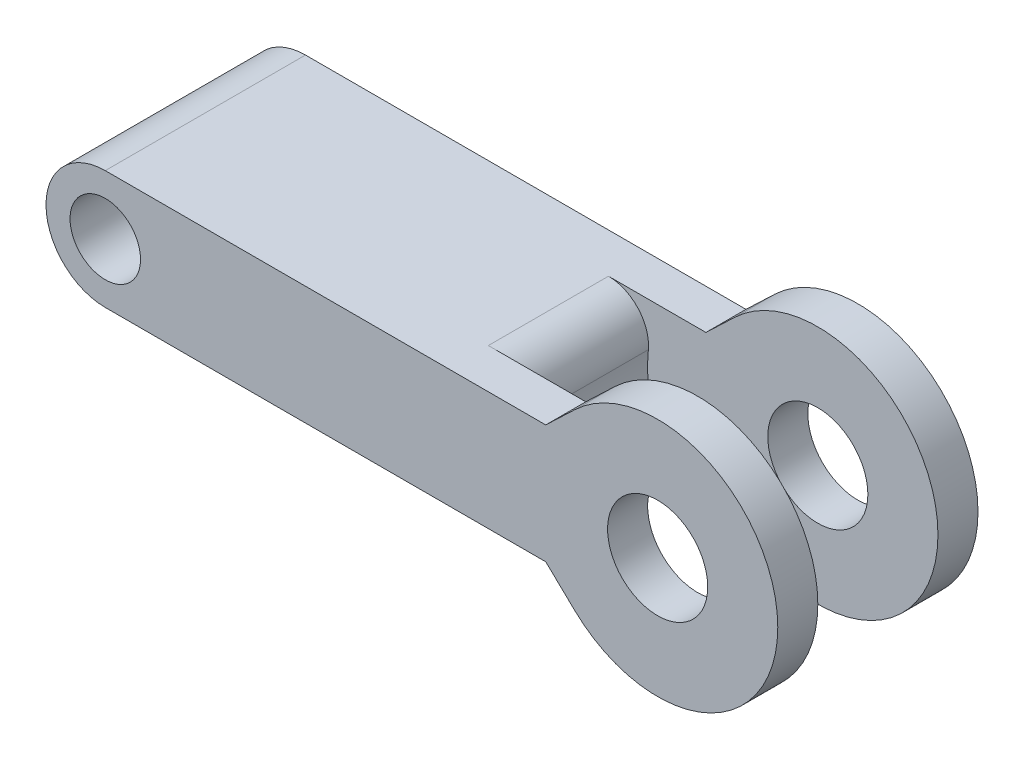
from build123d import *

# Parameters (mm, degrees)
BOSS_EXTRUDE1_DEPTH      = 5
BOSS_EXTRUDE1_DEPTH_BACK = 5
SKETCH1_R                = 1.76
SKETCH1_R_2              = 2.5
CUT_EXTRUDE1_DEPTH       = 3
CUT_EXTRUDE1_DEPTH_BACK  = 3
SKETCH1_4_R              = 8.5
SKETCH1_4_R_2            = 2.5
FILLET1_R                = 2


with BuildPart() as part:
    # Sketch1 → Boss-Extrude1 (new, two sides: drawn at the far end of the back side and taken through both)
    with BuildSketch(Plane.XY.offset(-BOSS_EXTRUDE1_DEPTH_BACK)):
        with BuildLine():
            ThreePointArc((-27.589132312, 2.96), (-30.549132312, 0), (-27.589132312, -2.96))
            Line((-27.589132312, -2.96), (-5.589132312, -2.96))
            Line((-5.589132312, -2.96), (-4.142219081, -4.340739694))
            ThreePointArc((-4.142219081, -4.340739694), (6, 0), (-4.142219081, 4.340739694))
            Line((-4.142219081, 4.340739694), (-5.589132312, 2.96))
            Line((-5.589132312, 2.96), (-27.589132312, 2.96))
        make_face()
        with Locations((-27.589132312, 0)):
            Circle(SKETCH1_R, mode=Mode.SUBTRACT)
        Circle(SKETCH1_R_2, mode=Mode.SUBTRACT)
    extrude(amount=BOSS_EXTRUDE1_DEPTH + BOSS_EXTRUDE1_DEPTH_BACK)

    # Sketch1<4> → Cut-Extrude1 (cut, two sides: drawn at the far end of the back side and taken through both)
    with BuildSketch(Plane.XY.offset(-CUT_EXTRUDE1_DEPTH_BACK)):
        Circle(SKETCH1_4_R)
        Circle(SKETCH1_4_R_2, mode=Mode.SUBTRACT)
    extrude(amount=CUT_EXTRUDE1_DEPTH + CUT_EXTRUDE1_DEPTH_BACK, mode=Mode.SUBTRACT)

    # Fillet1
    fillet1_edges = [part.edges().sort_by_distance(p)[0] for p in [
        (-7.967960843, 2.96, 0),
        (-7.967960843, -2.96, 0),
    ]]
    fillet(fillet1_edges, radius=FILLET1_R)


solid = part.part
